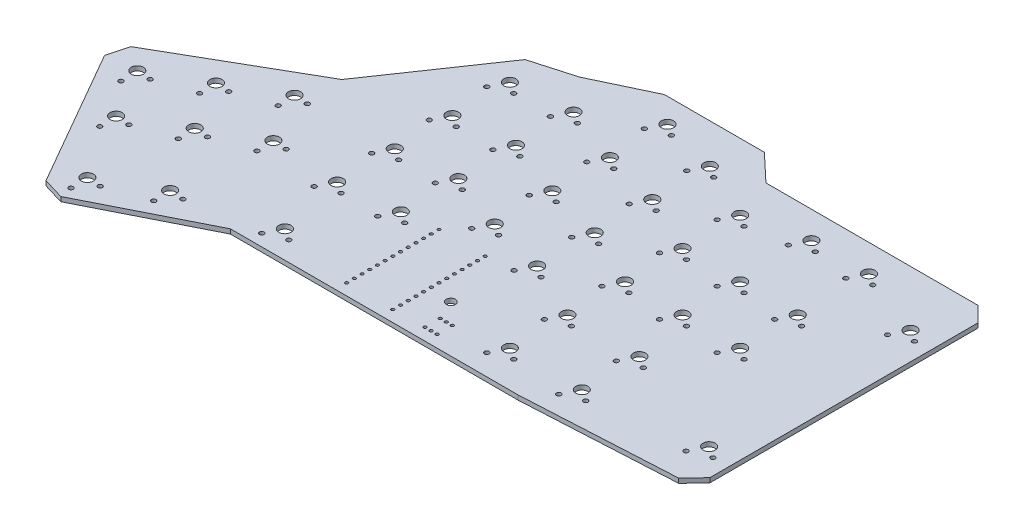
from build123d import *

# Parameters (mm, degrees)
MAIN_PLATE_DEPTH         = 1.5
SKETCH3_R                = 2
SWITCH_HOLES_MAIN_DEPTH  = 184.254174224
SKETCH4_R                = 0.75
SWITCH_HOLES_DEPTH       = 184.254174224
SKETCH5_R                = 0.5
SKETCH5_R_2              = 1.5
NICE_NANO_HOLES_DEPTH    = 184.254174224
SKETCH6_R                = 0.5
POWER_SWITCH_HOLES_DEPTH = 184.254174224


with BuildPart() as part:
    # Sketch2 → Main_plate (new body)
    with BuildSketch(Plane(origin=(0, 0, 0), x_dir=(1, 0, 0), z_dir=(0, 1, 0))):
        Polygon((71, 31), (38, 31), (19, 22), (5, 18), (-19.539258734, -17.929094976), (-63.752696337, -43.349007158), (-65.595198829, -50.175806157), (-39.444610582, -95.660125437), (-32.47623576, -97.748874012), (4.75, -79), (99.75, -79), (150, -76.271493213), (155, -71), (155, 17.5), (150, 22.5), (80, 22.5), align=None)
    extrude(amount=-MAIN_PLATE_DEPTH)

    # Sketch3 → Switch_holes_main (cut, through all)
    with BuildSketch(Plane(origin=(0, 0, 0), x_dir=(1, 0, 0), z_dir=(0, 1, 0))):
        with Locations(Location((-55.799108885, -49.157659897, 0), (0, 0, 270))):
            Circle(SKETCH3_R)
        with Locations(Location((-39.327436053, -39.687496535, 0), (0, 0, 270))):
            Circle(SKETCH3_R)
        with Locations(Location((-22.85576322, -30.217333173, 0), (0, 0, 270))):
            Circle(SKETCH3_R)
        with Locations(Location((-46.328945523, -65.62933273, 0), (0, 0, 270))):
            Circle(SKETCH3_R)
        with Locations(Location((-29.857272691, -56.159169368, 0), (0, 0, 270))):
            Circle(SKETCH3_R)
        with Locations(Location((-13.385599858, -46.689006006, 0), (0, 0, 270))):
            Circle(SKETCH3_R)
        with Locations(Location((-33.494382019, -87.952784068, 0), (0, 0, 270))):
            Circle(SKETCH3_R)
        with Locations(Location((-16.155779038, -77.984191056, 0), (0, 0, 270))):
            Circle(SKETCH3_R)
        with Locations(Location((13.75, -70, 0), (0, 0, 270))):
            Circle(SKETCH3_R)
        with Locations(Location((28, -46, 0), (0, 0, 270))):
            Circle(SKETCH3_R)
        with Locations(Location((9, -48, 0), (0, 0, 270))):
            Circle(SKETCH3_R)
        with Locations(Location((9, -29, 0), (0, 0, 270))):
            Circle(SKETCH3_R)
        with Locations(Location((28, -27, 0), (0, 0, 270))):
            Circle(SKETCH3_R)
        with Locations(Location((47, -34, 0), (0, 0, 270))):
            Circle(SKETCH3_R)
        with Locations(Location((66, -39, 0), (0, 0, 270))):
            Circle(SKETCH3_R)
        with Locations(Location((9, -10, 0), (0, 0, 270))):
            Circle(SKETCH3_R)
        with Locations(Location((9, 9, 0), (0, 0, 270))):
            Circle(SKETCH3_R)
        with Locations(Location((28, 11, 0), (0, 0, 270))):
            Circle(SKETCH3_R)
        with Locations(Location((47, 23, 0), (0, 0, 270))):
            Circle(SKETCH3_R)
        with Locations(Location((47, 4, 0), (0, 0, 270))):
            Circle(SKETCH3_R)
        with Locations(Location((28, -8, 0), (0, 0, 270))):
            Circle(SKETCH3_R)
        with Locations(Location((47, -15, 0), (0, 0, 270))):
            Circle(SKETCH3_R)
        with Locations(Location((66, 18, 0), (0, 0, 270))):
            Circle(SKETCH3_R)
        with Locations(Location((66, -1, 0), (0, 0, 270))):
            Circle(SKETCH3_R)
        with Locations(Location((66, -20, 0), (0, 0, 270))):
            Circle(SKETCH3_R)
        with Locations(Location((85, 9, 0), (0, 0, 270))):
            Circle(SKETCH3_R)
        with Locations(Location((104, 13.5, 0), (0, 0, 270))):
            Circle(SKETCH3_R)
        with Locations(Location((123, 13.5, 0), (0, 0, 270))):
            Circle(SKETCH3_R)
        with Locations(Location((146, 4.25, 0), (0, 0, 270))):
            Circle(SKETCH3_R)
        with Locations(Location((123, -10, 0), (0, 0, 270))):
            Circle(SKETCH3_R)
        with Locations(Location((104, -10, 0), (0, 0, 270))):
            Circle(SKETCH3_R)
        with Locations(Location((85, -10, 0), (0, 0, 270))):
            Circle(SKETCH3_R)
        with Locations(Location((85, -29, 0), (0, 0, 270))):
            Circle(SKETCH3_R)
        with Locations(Location((104, -29, 0), (0, 0, 270))):
            Circle(SKETCH3_R)
        with Locations(Location((123, -29, 0), (0, 0, 270))):
            Circle(SKETCH3_R)
        with Locations(Location((85, -48, 0), (0, 0, 270))):
            Circle(SKETCH3_R)
        with Locations(Location((108.75, -48, 0), (0, 0, 270))):
            Circle(SKETCH3_R)
        with Locations(Location((108.75, -67, 0), (0, 0, 270))):
            Circle(SKETCH3_R)
        with Locations(Location((146, -62.25, 0), (0, 0, 270))):
            Circle(SKETCH3_R)
        with Locations(Location((85, -67, 0), (0, 0, 270))):
            Circle(SKETCH3_R)
    extrude(amount=-SWITCH_HOLES_MAIN_DEPTH, mode=Mode.SUBTRACT)

    # Sketch4 → Switch_holes (cut, through all)
    with BuildSketch(Plane(origin=(0, 0, 0), x_dir=(1, 0, 0), z_dir=(0, 1, 0))):
        with Locations(Location((-55.540504123, -54.831382095, 0), (0, 0, 270))):
            Circle(SKETCH4_R)
        with Locations(Location((-51.234270651, -49.518148307, 0), (0, 0, 270))):
            Circle(SKETCH4_R)
        with Locations(Location((-39.068831291, -45.361218733, 0), (0, 0, 270))):
            Circle(SKETCH4_R)
        with Locations(Location((-34.762597818, -40.047984945, 0), (0, 0, 270))):
            Circle(SKETCH4_R)
        with Locations(Location((-22.597158458, -35.891055371, 0), (0, 0, 270))):
            Circle(SKETCH4_R)
        with Locations(Location((-18.290924986, -30.577821583, 0), (0, 0, 270))):
            Circle(SKETCH4_R)
        with Locations(Location((25.46, -51.08, 0), (0, 0, 270))):
            Circle(SKETCH4_R)
        with Locations(Location((149.81, 1.71, 0), (0, 0, 270))):
            Circle(SKETCH4_R)
        with Locations(Location((143.46, -0.83, 0), (0, 0, 270))):
            Circle(SKETCH4_R)
        with Locations(Location((88.81, -69.54, 0), (0, 0, 270))):
            Circle(SKETCH4_R)
        with Locations(Location((120.46, 8.42, 0), (0, 0, 270))):
            Circle(SKETCH4_R)
        with Locations(Location((126.81, 10.96, 0), (0, 0, 270))):
            Circle(SKETCH4_R)
        with Locations(Location((126.81, -12.54, 0), (0, 0, 270))):
            Circle(SKETCH4_R)
        with Locations(Location((120.46, -15.08, 0), (0, 0, 270))):
            Circle(SKETCH4_R)
        with Locations(Location((143.46, -67.33, 0), (0, 0, 270))):
            Circle(SKETCH4_R)
        with Locations(Location((149.81, -64.79, 0), (0, 0, 270))):
            Circle(SKETCH4_R)
        with Locations(Location((126.81, -31.54, 0), (0, 0, 270))):
            Circle(SKETCH4_R)
        with Locations(Location((120.46, -34.08, 0), (0, 0, 270))):
            Circle(SKETCH4_R)
        with Locations(Location((107.81, -31.54, 0), (0, 0, 270))):
            Circle(SKETCH4_R)
        with Locations(Location((101.46, -34.08, 0), (0, 0, 270))):
            Circle(SKETCH4_R)
        with Locations(Location((106.21, -53.08, 0), (0, 0, 270))):
            Circle(SKETCH4_R)
        with Locations(Location((112.56, -50.54, 0), (0, 0, 270))):
            Circle(SKETCH4_R)
        with Locations(Location((112.56, -69.54, 0), (0, 0, 270))):
            Circle(SKETCH4_R)
        with Locations(Location((106.21, -72.08, 0), (0, 0, 270))):
            Circle(SKETCH4_R)
        with Locations(Location((107.81, 10.96, 0), (0, 0, 270))):
            Circle(SKETCH4_R)
        with Locations(Location((101.46, 8.42, 0), (0, 0, 270))):
            Circle(SKETCH4_R)
        with Locations(Location((107.81, -12.54, 0), (0, 0, 270))):
            Circle(SKETCH4_R)
        with Locations(Location((101.46, -15.08, 0), (0, 0, 270))):
            Circle(SKETCH4_R)
        with Locations(Location((88.81, -12.54, 0), (0, 0, 270))):
            Circle(SKETCH4_R)
        with Locations(Location((82.46, -15.08, 0), (0, 0, 270))):
            Circle(SKETCH4_R)
        with Locations(Location((82.46, 3.92, 0), (0, 0, 270))):
            Circle(SKETCH4_R)
        with Locations(Location((88.81, 6.46, 0), (0, 0, 270))):
            Circle(SKETCH4_R)
        with Locations(Location((88.81, -31.54, 0), (0, 0, 270))):
            Circle(SKETCH4_R)
        with Locations(Location((82.46, -34.08, 0), (0, 0, 270))):
            Circle(SKETCH4_R)
        with Locations(Location((69.81, 15.46, 0), (0, 0, 270))):
            Circle(SKETCH4_R)
        with Locations(Location((63.46, 12.92, 0), (0, 0, 270))):
            Circle(SKETCH4_R)
        with Locations(Location((69.81, -3.54, 0), (0, 0, 270))):
            Circle(SKETCH4_R)
        with Locations(Location((63.46, -6.08, 0), (0, 0, 270))):
            Circle(SKETCH4_R)
        with Locations(Location((69.81, -22.54, 0), (0, 0, 270))):
            Circle(SKETCH4_R)
        with Locations(Location((63.46, -25.08, 0), (0, 0, 270))):
            Circle(SKETCH4_R)
        with Locations(Location((63.46, -44.08, 0), (0, 0, 270))):
            Circle(SKETCH4_R)
        with Locations(Location((69.81, -41.54, 0), (0, 0, 270))):
            Circle(SKETCH4_R)
        with Locations(Location((88.81, -50.54, 0), (0, 0, 270))):
            Circle(SKETCH4_R)
        with Locations(Location((82.46, -53.08, 0), (0, 0, 270))):
            Circle(SKETCH4_R)
        with Locations(Location((31.81, -48.54, 0), (0, 0, 270))):
            Circle(SKETCH4_R)
        with Locations(Location((44.46, -39.08, 0), (0, 0, 270))):
            Circle(SKETCH4_R)
        with Locations(Location((50.81, -36.54, 0), (0, 0, 270))):
            Circle(SKETCH4_R)
        with Locations(Location((44.46, -20.08, 0), (0, 0, 270))):
            Circle(SKETCH4_R)
        with Locations(Location((50.81, -17.54, 0), (0, 0, 270))):
            Circle(SKETCH4_R)
        with Locations(Location((31.81, -29.54, 0), (0, 0, 270))):
            Circle(SKETCH4_R)
        with Locations(Location((25.46, -32.08, 0), (0, 0, 270))):
            Circle(SKETCH4_R)
        with Locations(Location((25.46, -13.08, 0), (0, 0, 270))):
            Circle(SKETCH4_R)
        with Locations(Location((31.81, -10.54, 0), (0, 0, 270))):
            Circle(SKETCH4_R)
        with Locations(Location((12.81, -12.54, 0), (0, 0, 270))):
            Circle(SKETCH4_R)
        with Locations(Location((6.46, -15.08, 0), (0, 0, 270))):
            Circle(SKETCH4_R)
        with Locations(Location((6.46, 3.92, 0), (0, 0, 270))):
            Circle(SKETCH4_R)
        with Locations(Location((12.81, 6.46, 0), (0, 0, 270))):
            Circle(SKETCH4_R)
        with Locations(Location((25.46, 5.92, 0), (0, 0, 270))):
            Circle(SKETCH4_R)
        with Locations(Location((31.81, 8.46, 0), (0, 0, 270))):
            Circle(SKETCH4_R)
        with Locations(Location((44.46, 17.92, 0), (0, 0, 270))):
            Circle(SKETCH4_R)
        with Locations(Location((50.81, 20.46, 0), (0, 0, 270))):
            Circle(SKETCH4_R)
        with Locations(Location((50.81, 1.46, 0), (0, 0, 270))):
            Circle(SKETCH4_R)
        with Locations(Location((44.46, -1.08, 0), (0, 0, 270))):
            Circle(SKETCH4_R)
        with Locations(Location((12.81, -31.54, 0), (0, 0, 270))):
            Circle(SKETCH4_R)
        with Locations(Location((6.46, -34.08, 0), (0, 0, 270))):
            Circle(SKETCH4_R)
        with Locations(Location((12.81, -50.54, 0), (0, 0, 270))):
            Circle(SKETCH4_R)
        with Locations(Location((6.46, -53.08, 0), (0, 0, 270))):
            Circle(SKETCH4_R)
        with Locations(Location((17.56, -72.54, 0), (0, 0, 270))):
            Circle(SKETCH4_R)
        with Locations(Location((11.21, -75.08, 0), (0, 0, 270))):
            Circle(SKETCH4_R)
        with Locations(Location((-8.820761624, -47.049494416, 0), (0, 0, 270))):
            Circle(SKETCH4_R)
        with Locations(Location((-13.126995096, -52.362728203, 0), (0, 0, 270))):
            Circle(SKETCH4_R)
        with Locations(Location((-25.292434456, -56.519657778, 0), (0, 0, 270))):
            Circle(SKETCH4_R)
        with Locations(Location((-29.598667929, -61.832891565, 0), (0, 0, 270))):
            Circle(SKETCH4_R)
        with Locations(Location((-41.764107289, -65.98982114, 0), (0, 0, 270))):
            Circle(SKETCH4_R)
        with Locations(Location((-46.070340761, -71.303054927, 0), (0, 0, 270))):
            Circle(SKETCH4_R)
        with Locations(Location((-28.929543785, -88.313272478, 0), (0, 0, 270))):
            Circle(SKETCH4_R)
        with Locations(Location((-33.235777257, -93.626506266, 0), (0, 0, 270))):
            Circle(SKETCH4_R)
        with Locations(Location((-15.897174276, -83.657913253, 0), (0, 0, 270))):
            Circle(SKETCH4_R)
        with Locations(Location((-11.590940803, -78.344679466, 0), (0, 0, 270))):
            Circle(SKETCH4_R)
        with Locations(Location((82.46, -72.08, 0), (0, 0, 270))):
            Circle(SKETCH4_R)
    extrude(amount=-SWITCH_HOLES_DEPTH, mode=Mode.SUBTRACT)

    # Sketch5 → Nice_nano_holes (cut, through all)
    with BuildSketch(Plane(origin=(0, 0, 0), x_dir=(1, 0, 0), z_dir=(0, 1, 0))):
        with Locations(Location((39.38, -75.25, 0), (0, 0, 270))):
            Circle(SKETCH5_R)
        with Locations(Location((39.38, -72.71, 0), (0, 0, 270))):
            Circle(SKETCH5_R)
        with Locations(Location((39.38, -70.17, 0), (0, 0, 270))):
            Circle(SKETCH5_R)
        with Locations(Location((39.38, -67.63, 0), (0, 0, 270))):
            Circle(SKETCH5_R)
        with Locations(Location((39.38, -65.09, 0), (0, 0, 270))):
            Circle(SKETCH5_R)
        with Locations(Location((39.38, -62.55, 0), (0, 0, 270))):
            Circle(SKETCH5_R)
        with Locations(Location((39.38, -60.01, 0), (0, 0, 270))):
            Circle(SKETCH5_R)
        with Locations(Location((39.38, -57.47, 0), (0, 0, 270))):
            Circle(SKETCH5_R)
        with Locations(Location((39.38, -54.93, 0), (0, 0, 270))):
            Circle(SKETCH5_R)
        with Locations(Location((39.38, -52.39, 0), (0, 0, 270))):
            Circle(SKETCH5_R)
        with Locations(Location((39.38, -49.85, 0), (0, 0, 270))):
            Circle(SKETCH5_R)
        with Locations(Location((39.38, -47.31, 0), (0, 0, 270))):
            Circle(SKETCH5_R)
        with Locations(Location((39.38, -44.77, 0), (0, 0, 270))):
            Circle(SKETCH5_R)
        with Locations(Location((54.62, -44.77, 0), (0, 0, 90))):
            Circle(SKETCH5_R)
        with Locations(Location((54.62, -47.31, 0), (0, 0, 90))):
            Circle(SKETCH5_R)
        with Locations(Location((54.62, -49.85, 0), (0, 0, 90))):
            Circle(SKETCH5_R)
        with Locations(Location((54.62, -52.39, 0), (0, 0, 90))):
            Circle(SKETCH5_R)
        with Locations(Location((54.62, -54.93, 0), (0, 0, 90))):
            Circle(SKETCH5_R)
        with Locations(Location((54.62, -57.47, 0), (0, 0, 90))):
            Circle(SKETCH5_R)
        with Locations(Location((54.62, -60.01, 0), (0, 0, 90))):
            Circle(SKETCH5_R)
        with Locations(Location((54.62, -62.55, 0), (0, 0, 90))):
            Circle(SKETCH5_R)
        with Locations(Location((54.62, -65.09, 0), (0, 0, 90))):
            Circle(SKETCH5_R)
        with Locations(Location((54.62, -67.63, 0), (0, 0, 90))):
            Circle(SKETCH5_R)
        with Locations(Location((54.62, -70.17, 0), (0, 0, 90))):
            Circle(SKETCH5_R)
        with Locations(Location((54.62, -72.71, 0), (0, 0, 90))):
            Circle(SKETCH5_R)
        with Locations(Location((54.62, -75.25, 0), (0, 0, 90))):
            Circle(SKETCH5_R)
        with Locations(Location((62, -63.5, 0), (0, 0, 270))):
            Circle(SKETCH5_R_2)
    extrude(amount=-NICE_NANO_HOLES_DEPTH, mode=Mode.SUBTRACT)

    # Sketch6 → Power_switch_holes (cut, through all)
    with BuildSketch(Plane(origin=(0, 0, 0), x_dir=(1, 0, 0), z_dir=(0, 1, 0))):
        with Locations(Location((65, -75, 0), (0, 0, 270))):
            Circle(SKETCH6_R)
        with Locations(Location((69, -75, 0), (0, 0, 270))):
            Circle(SKETCH6_R)
        with Locations(Location((67, -75, 0), (0, 0, 270))):
            Circle(SKETCH6_R)
        with Locations(Location((69, -70, 0), (0, 0, 270))):
            Circle(SKETCH6_R)
        with Locations(Location((65, -70, 0), (0, 0, 270))):
            Circle(SKETCH6_R)
        with Locations(Location((67, -70, 0), (0, 0, 270))):
            Circle(SKETCH6_R)
    extrude(amount=-POWER_SWITCH_HOLES_DEPTH, mode=Mode.SUBTRACT)


solid = part.part
